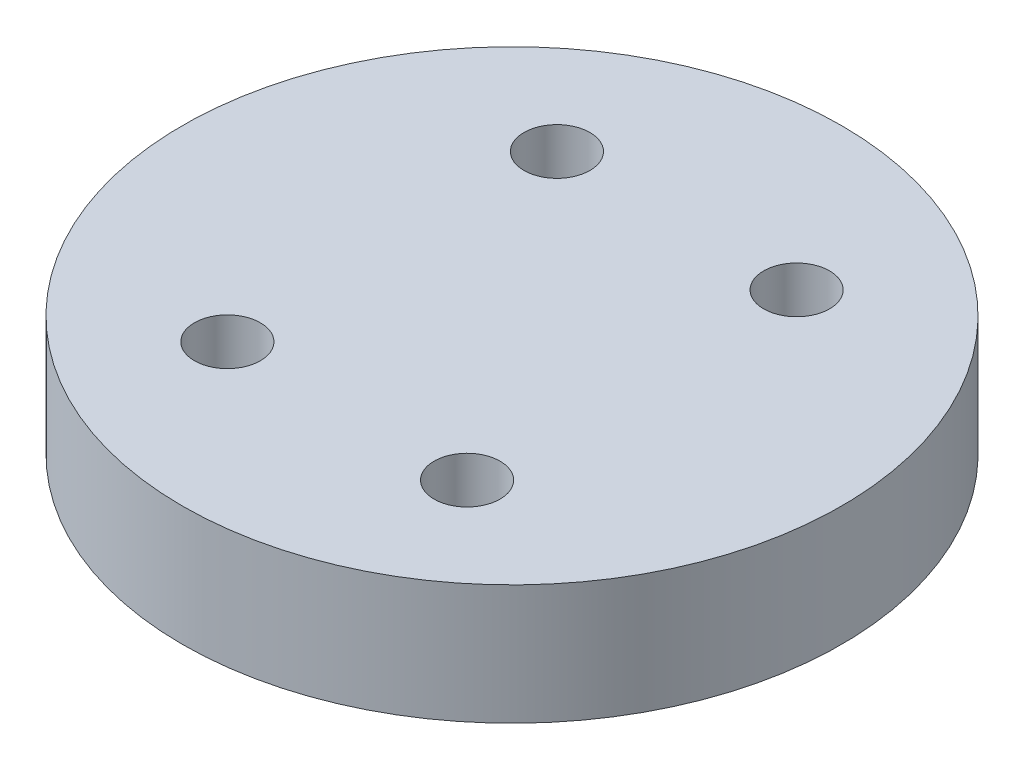
from build123d import *

# Parameters (mm, degrees)
SKETCH1_R           = 27.5
SKETCH1_R_2         = 2.75
BOSS_EXTRUDE1_DEPTH = 10


with BuildPart() as part:
    # Sketch1 → Boss-Extrude1 (new body)
    with BuildSketch(Plane(origin=(0, 0, 0), x_dir=(1, 0, 0), z_dir=(0, 1, 0))):
        with Locations(Location((0, 0, 0), (0, 0, 270))):
            Circle(SKETCH1_R)
        with Locations(Location((-10, 13.75, 0), (0, 0, 270))):
            Circle(SKETCH1_R_2, mode=Mode.SUBTRACT)
        with Locations(Location((10, 13.75, 0), (0, 0, 270))):
            Circle(SKETCH1_R_2, mode=Mode.SUBTRACT)
        with Locations(Location((10, -13.75, 0), (0, 0, 270))):
            Circle(SKETCH1_R_2, mode=Mode.SUBTRACT)
        with Locations(Location((-10, -13.75, 0), (0, 0, 270))):
            Circle(SKETCH1_R_2, mode=Mode.SUBTRACT)
    extrude(amount=BOSS_EXTRUDE1_DEPTH)


solid = part.part
